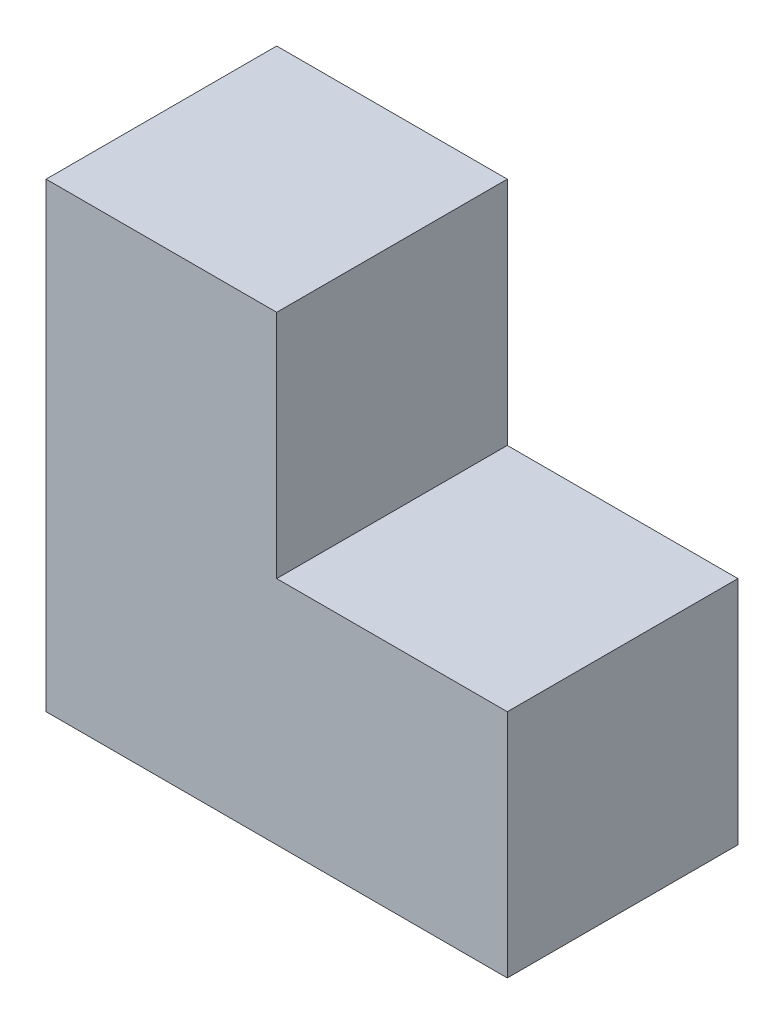
from build123d import *

# Parameters (mm, degrees)
BOSS_EXTRU_1_DEPTH = 300


with BuildPart() as part:
    # Esquisse1 → Boss.-Extru.1 (new body)
    with BuildSketch(Plane.XY):
        Polygon((0, 0), (0, 600), (300, 600), (300, 300), (600, 300), (600, 0), align=None)
    extrude(amount=BOSS_EXTRU_1_DEPTH)


solid = part.part
